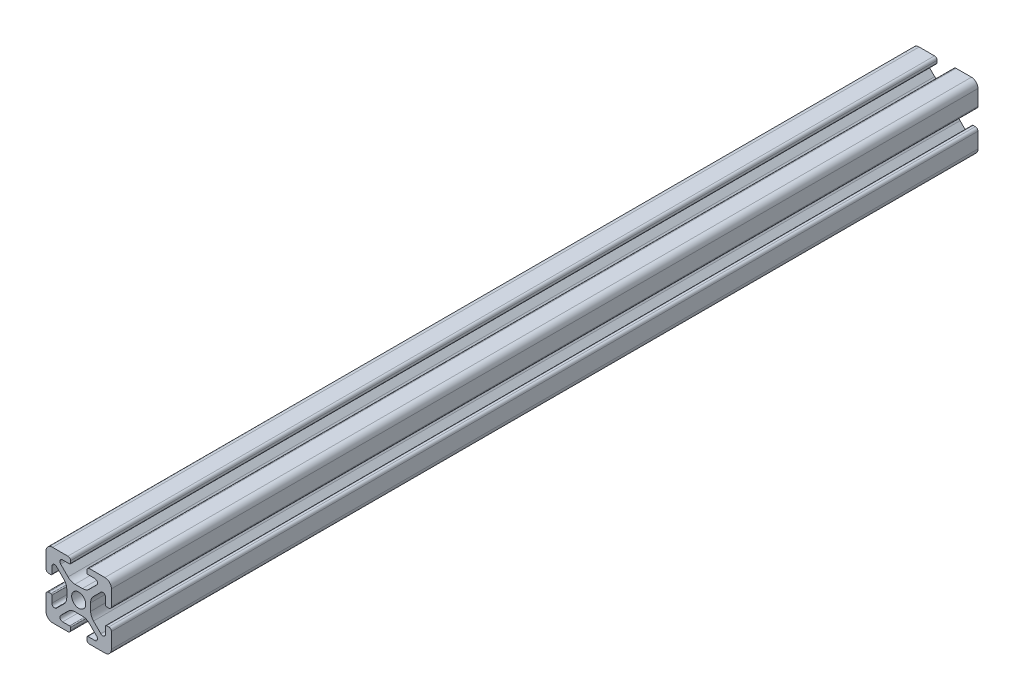
from build123d import *

# Parameters (mm, degrees)
ESQUISSE1_R        = 2.15
BOSS_EXTRU_1_DEPTH = 265


with BuildPart() as part:
    # Esquisse1 → Boss.-Extru.1 (new body)
    with BuildSketch(Plane(origin=(0, 0, 0), x_dir=(-1, 0, 0), z_dir=(0, 0, -1))):
        with BuildLine():
            Line((-12.499999997, 0.800000003), (-12.499999998, 1.500000003))
            ThreePointArc((-12.499999998, 1.500000003), (-12.587867964, 1.712132039), (-12.8, 1.800000005))
            Line((-12.8, 1.800000005), (-14.9175884, 1.800000005))
            ThreePointArc((-14.9175884, 1.800000005), (-15.686636444, 2.31386148), (-15.50619229, 3.2210155))
            Line((-15.50619229, 3.2210155), (-13.25588745, 5.47132034))
            ThreePointArc((-13.25588745, 5.47132034), (-12.282617404, 6.121638593), (-11.134567108, 6.349999996))
            Line((-11.134567108, 6.349999996), (-8.865432907, 6.349999996))
            ThreePointArc((-8.865432907, 6.349999996), (-7.717382611, 6.121638594), (-6.744112567, 5.471320341))
            Line((-6.744112567, 5.471320341), (-4.493807729, 3.221015503))
            ThreePointArc((-4.493807729, 3.221015503), (-4.313363575, 2.313861481), (-5.082411621, 1.800000005))
            Line((-5.082411621, 1.800000005), (-7.20000001, 1.800000005))
            ThreePointArc((-7.20000001, 1.800000005), (-7.412132045, 1.71213204), (-7.50000001, 1.500000005))
            Line((-7.50000001, 1.500000005), (-7.50000001, 0.8))
            ThreePointArc((-7.50000001, 0.8), (-7.265685435, 0.234314575), (-6.70000001, 0))
            Line((-6.70000001, 0), (-2, 0))
            ThreePointArc((-2, 0), (-0.585786438, 0.585786438), (0, 2))
            Line((0, 2), (0, 6.699999998))
            ThreePointArc((0, 6.699999998), (-0.234314576, 7.265685424), (-0.800000003, 7.5))
            Line((-0.800000003, 7.5), (-1.50000001, 7.5))
            ThreePointArc((-1.50000001, 7.5), (-1.712132046, 7.412132033), (-1.800000013, 7.199999997))
            Line((-1.800000013, 7.199999997), (-1.800000013, 5.082411603))
            ThreePointArc((-1.800000013, 5.082411603), (-2.313861487, 4.31336356), (-3.221015507, 4.493807713))
            Line((-3.221015507, 4.493807713), (-5.471320347, 6.744112553))
            ThreePointArc((-5.471320347, 6.744112553), (-6.1216386, 7.717382599), (-6.350000003, 8.865432896))
            Line((-6.350000003, 8.865432896), (-6.350000003, 11.134567102))
            ThreePointArc((-6.350000003, 11.134567102), (-6.121638601, 12.282617397), (-5.471320348, 13.255887442))
            Line((-5.471320348, 13.255887442), (-3.221015512, 15.506192278))
            ThreePointArc((-3.221015512, 15.506192278), (-2.313861489, 15.686636432), (-1.800000013, 14.917588386))
            Line((-1.800000013, 14.917588386), (-1.800000013, 12.799999998))
            ThreePointArc((-1.800000013, 12.799999998), (-1.712132047, 12.587867963), (-1.500000013, 12.499999997))
            Line((-1.500000013, 12.499999997), (-0.8, 12.499999997))
            ThreePointArc((-0.8, 12.499999997), (-0.234314575, 12.734314573), (0, 13.299999998))
            Line((0, 13.299999998), (0, 18))
            ThreePointArc((0, 18), (-0.585786438, 19.414213562), (-2, 20))
            Line((-2, 20), (-6.700000008, 20))
            ThreePointArc((-6.700000008, 20), (-7.265685435, 19.765685424), (-7.50000001, 19.199999998))
            Line((-7.50000001, 19.199999998), (-7.50000001, 18.500000005))
            ThreePointArc((-7.50000001, 18.500000005), (-7.412132044, 18.287867969), (-7.200000008, 18.200000003))
            Line((-7.200000008, 18.200000003), (-5.082411594, 18.200000003))
            ThreePointArc((-5.082411594, 18.200000003), (-4.313363546, 17.686138526), (-4.493807701, 16.778984501))
            Line((-4.493807701, 16.778984501), (-6.744112542, 14.528679659))
            ThreePointArc((-6.744112542, 14.528679659), (-7.717382588, 13.878361406), (-8.865432885, 13.650000003))
            Line((-8.865432885, 13.650000003), (-11.134567112, 13.650000003))
            ThreePointArc((-11.134567112, 13.650000003), (-12.282617407, 13.878361405), (-13.255887452, 14.528679658))
            Line((-13.255887452, 14.528679658), (-15.506192292, 16.778984498))
            ThreePointArc((-15.506192292, 16.778984498), (-15.686636447, 17.686138525), (-14.917588397, 18.200000002))
            Line((-14.917588397, 18.200000002), (-12.799999998, 18.200000003))
            ThreePointArc((-12.799999998, 18.200000003), (-12.587867963, 18.287867968), (-12.499999997, 18.500000002))
            Line((-12.499999997, 18.500000002), (-12.499999997, 19.2))
            ThreePointArc((-12.499999997, 19.2), (-12.734314573, 19.765685425), (-13.299999998, 20))
            Line((-13.299999998, 20), (-18, 20))
            ThreePointArc((-18, 20), (-19.414213562, 19.414213562), (-20, 18))
            Line((-20, 18), (-20, 13.3))
            ThreePointArc((-20, 13.3), (-19.765685424, 12.734314573), (-19.199999998, 12.499999997))
            Line((-19.199999998, 12.499999997), (-18.500000003, 12.499999997))
            ThreePointArc((-18.500000003, 12.499999997), (-18.287867967, 12.587867964), (-18.2, 12.8))
            Line((-18.2, 12.8), (-18.2, 14.91758839))
            ThreePointArc((-18.2, 14.91758839), (-17.686138526, 15.686636434), (-16.778984506, 15.50619228))
            Line((-16.778984506, 15.50619228), (-14.528679657, 13.255887431))
            ThreePointArc((-14.528679657, 13.255887431), (-13.878361403, 12.282617385), (-13.650000001, 11.134567088))
            Line((-13.650000001, 11.134567088), (-13.650000001, 8.865432886))
            ThreePointArc((-13.650000001, 8.865432886), (-13.878361403, 7.717382591), (-14.528679656, 6.744112546))
            Line((-14.528679656, 6.744112546), (-16.778984496, 4.493807706))
            ThreePointArc((-16.778984496, 4.493807706), (-17.686138522, 4.313363551), (-18.2, 5.0824116))
            Line((-18.2, 5.0824116), (-18.2, 7.2))
            ThreePointArc((-18.2, 7.2), (-18.287867966, 7.412132034), (-18.5, 7.5))
            Line((-18.5, 7.5), (-19.2, 7.5))
            ThreePointArc((-19.2, 7.5), (-19.765685425, 7.265685425), (-20, 6.7))
            Line((-20, 6.7), (-20, 2))
            ThreePointArc((-20, 2), (-19.414213562, 0.585786438), (-18, 0))
            Line((-18, 0), (-13.3, 0))
            ThreePointArc((-13.3, 0), (-12.734314573, 0.234314576), (-12.499999997, 0.800000003))
        make_face()
        with Locations(Location((-10, 10, 0), (0, 0, 180))):
            Circle(ESQUISSE1_R, mode=Mode.SUBTRACT)
    extrude(amount=-BOSS_EXTRU_1_DEPTH)


solid = part.part
